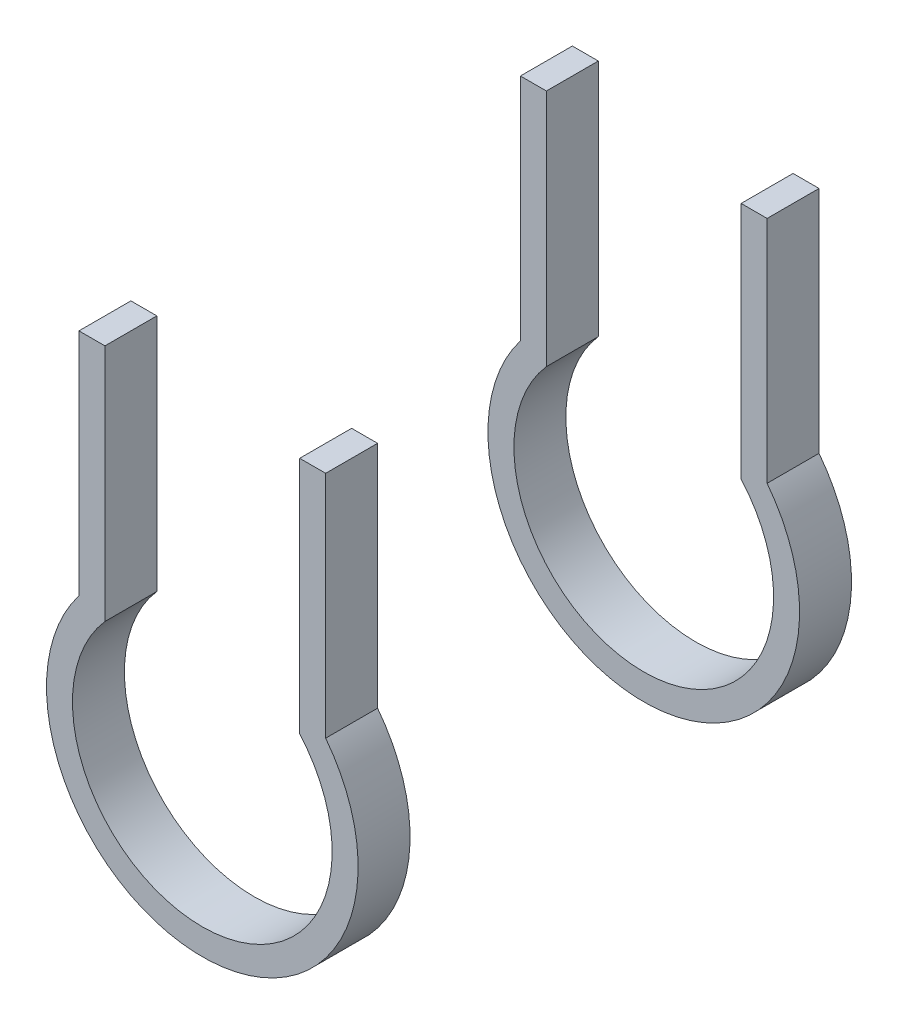
from build123d import *

# Parameters (mm, degrees)
EXTRUDE_1_DEPTH          = 76
CUT_EXTRUDE_2_DEPTH      = 30
CUT_EXTRUDE_2_DEPTH_BACK = 30
SKETCH_3_W               = 62.399704462
SKETCH_3_H               = 130


with BuildPart() as part:
    # 草图1 → 凸台-拉伸1 (new body)
    with BuildSketch(Plane.XY):
        with BuildLine():
            Line((-19, 50), (-19, 14.662878299))
            ThreePointArc((-19, 14.662878299), (0, -24), (19, 14.662878299))
            Line((19, 14.662878299), (19, 50))
            Line((19, 50), (15, 50))
            Line((15, 50), (15, 13.228756555))
            ThreePointArc((15, 13.228756555), (0, -20), (-15, 13.228756555))
            Line((-15, 13.228756555), (-15, 50))
            Line((-15, 50), (-19, 50))
        make_face()
    extrude(amount=EXTRUDE_1_DEPTH)

    # 草图3 → 切除-拉伸2 (cut, two sides: drawn at the far end of the back side and taken through both)
    with BuildSketch(Plane.XY.offset(38).offset(-CUT_EXTRUDE_2_DEPTH_BACK)):
        with Locations((-5.457937597, -9.843031008)):
            Rectangle(SKETCH_3_W, SKETCH_3_H)
    extrude(amount=CUT_EXTRUDE_2_DEPTH + CUT_EXTRUDE_2_DEPTH_BACK, mode=Mode.SUBTRACT)


with BuildPart() as cut_extrude_2_piece_1:
    # of the separate pieces the step leaves, piece 1, a body of its own (cut_extrude_2_pieces)
    add(part.part.solids().sort_by_distance((-15, 13.228756555, 0))[0])


with BuildPart() as cut_extrude_2_piece_2:
    # of the separate pieces the step leaves, piece 2, a body of its own (cut_extrude_2_pieces)
    add(part.part.solids().sort_by_distance((-15, 50, 68))[0])


solid = Compound([cut_extrude_2_piece_1.part, cut_extrude_2_piece_2.part])
